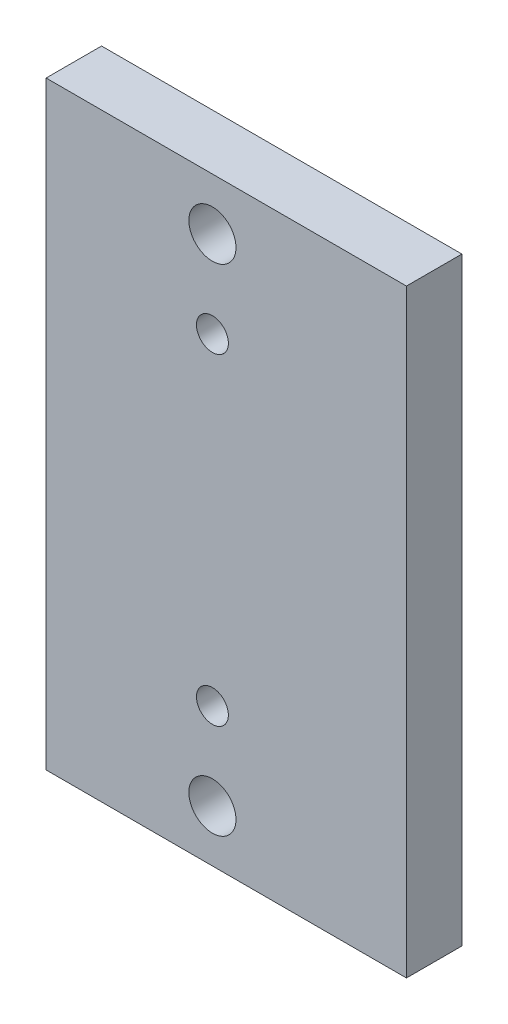
from build123d import *

# Parameters (mm, degrees)
SKETCH1_W           = 26
SKETCH1_H           = 43.24
SKETCH1_R           = 1.7
SKETCH1_R_2         = 1.15
BOSS_EXTRUDE1_DEPTH = 4


with BuildPart() as part:
    # Sketch1 → Boss-Extrude1 (new body)
    with BuildSketch(Plane.XY):
        with Locations((9, 5)):
            Rectangle(SKETCH1_W, SKETCH1_H)
        with Locations((8, -12.87)):
            Circle(SKETCH1_R, mode=Mode.SUBTRACT)
        with Locations((8, 22.87)):
            Circle(SKETCH1_R, mode=Mode.SUBTRACT)
        with Locations((8, -6.62)):
            Circle(SKETCH1_R_2, mode=Mode.SUBTRACT)
        with Locations((8, 16.62)):
            Circle(SKETCH1_R_2, mode=Mode.SUBTRACT)
    extrude(amount=BOSS_EXTRUDE1_DEPTH)


solid = part.part
